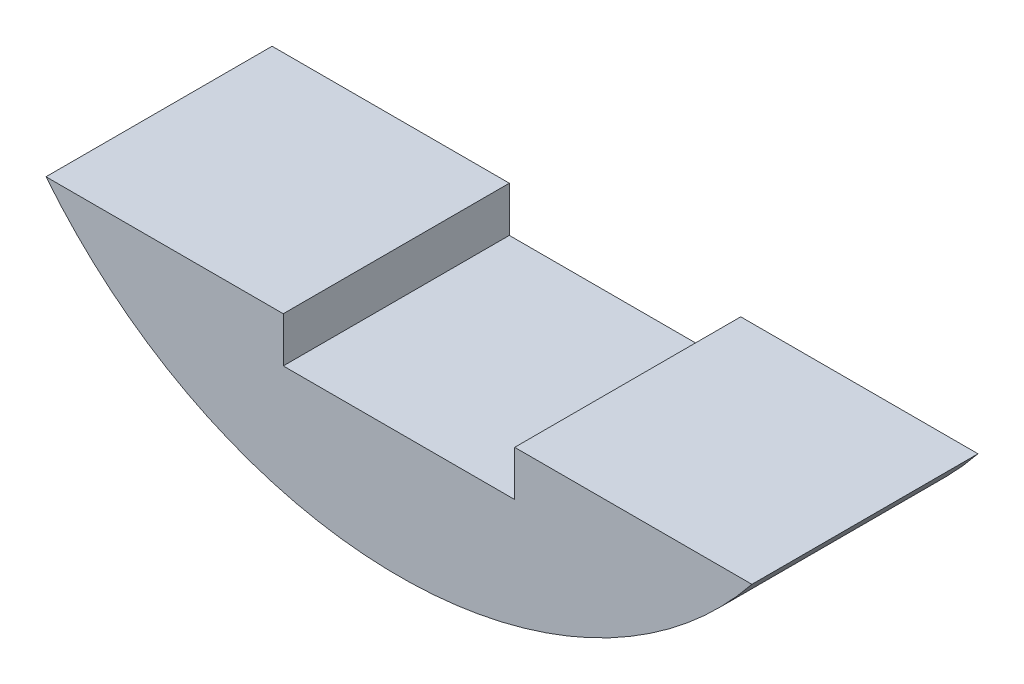
from build123d import *

# Parameters (mm, degrees)
BOSS_EXTRUDE1_DEPTH = 25.4
SKETCH4_W           = 26
SKETCH4_H           = 25.4
CUT_EXTRUDE3_DEPTH  = 5.08


with BuildPart() as part:
    # Sketch1 → Boss-Extrude1 (new body)
    with BuildSketch(Plane.XY):
        with BuildLine():
            Line((0, 0), (79.31147458, 0))
            ThreePointArc((79.31147458, 0), (39.65573729, -19.05), (0, 0))
        make_face()
    extrude(amount=BOSS_EXTRUDE1_DEPTH)

    # Sketch4 → Cut-Extrude3 (cut)
    with BuildSketch(Plane(origin=(0, 0, 0), x_dir=(1, 0, 0), z_dir=(0, 1, 0))):
        with Locations((39.65573729, -12.7)):
            Rectangle(SKETCH4_W, SKETCH4_H)
    extrude(amount=-CUT_EXTRUDE3_DEPTH, mode=Mode.SUBTRACT)


solid = part.part
